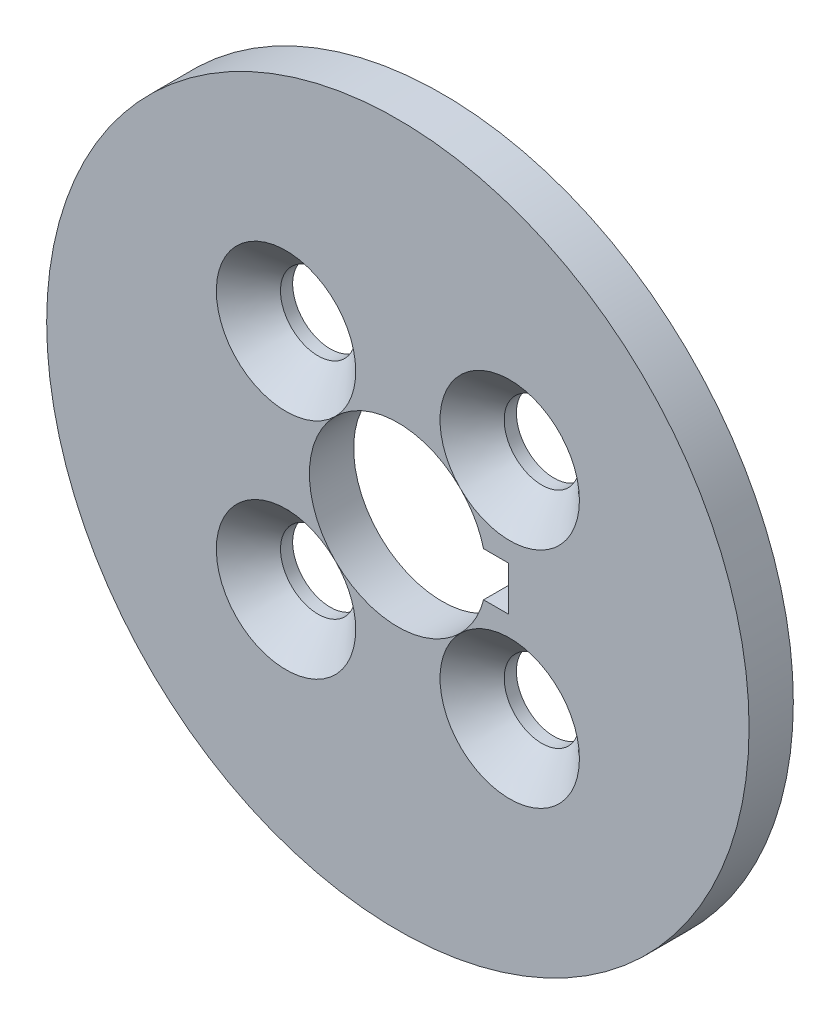
from build123d import *

# Parameters (mm, degrees)
SKETCH2_R                                      = 15.875
SKETCH2_R_2                                    = 1.7
SKETCH2_R_3                                    = 4
BOSS_EXTRUDE1_DEPTH                            = 2
CSK_FOR_M3_FLAT_HEAD_MACHINE_SCREW2_AT_2_COUNT = 2
CSK_FOR_M3_FLAT_HEAD_MACHINE_SCREW2_AT_2_PITCH = 10.111626971
CSK_FOR_M3_FLAT_HEAD_MACHINE_SCREW2_AT_3_COUNT = 2
CSK_FOR_M3_FLAT_HEAD_MACHINE_SCREW2_AT_3_PITCH = 14.3
CSK_FOR_M3_FLAT_HEAD_MACHINE_SCREW2_AT_4_COUNT = 2
CSK_FOR_M3_FLAT_HEAD_MACHINE_SCREW2_AT_4_PITCH = 10.111626971
SKETCH5_W                                      = 1.314472485
SKETCH5_H                                      = 2
CUT_EXTRUDE1_DEPTH                             = 211.522713644


with BuildPart() as part:
    # Sketch2 → Boss-Extrude1 (new body)
    with BuildSketch(Plane.XY):
        with Locations((-160.606756626, 98.885631483)):
            Circle(SKETCH2_R)
        with Locations((-165.662570112, 103.941444968)):
            Circle(SKETCH2_R_2, mode=Mode.SUBTRACT)
        with Locations((-155.550943141, 103.941444968)):
            Circle(SKETCH2_R_2, mode=Mode.SUBTRACT)
        with Locations((-155.550943141, 93.829817997)):
            Circle(SKETCH2_R_2, mode=Mode.SUBTRACT)
        with Locations((-165.662570112, 93.829817997)):
            Circle(SKETCH2_R_2, mode=Mode.SUBTRACT)
        with Locations((-160.606756626, 98.885631483)):
            Circle(SKETCH2_R_3, mode=Mode.SUBTRACT)
    extrude(amount=BOSS_EXTRUDE1_DEPTH)

    # Sketch4 → CSK for M3 Flat Head Machine Screw2 (revolve, cut)
    with BuildSketch(Plane(origin=(-165.662570112, 103.941444968, 2), x_dir=(0, -1, 0), z_dir=(1, 0, 0))):
        Polygon((0, 0), (0, 2), (1.7, 2), (1.7, 1.45), (3.15, 0), align=None)
    csk_for_m3_flat_head_machine_screw2 = revolve(axis=Axis((-165.662570112, 103.941444968, 8.35), (0, 0, -1)), mode=Mode.SUBTRACT)

    # CSK for M3 Flat Head Machine Screw2 at 2: CSK for M3 Flat Head Machine Screw2 ×2
    with Locations(*[(i * CSK_FOR_M3_FLAT_HEAD_MACHINE_SCREW2_AT_2_PITCH, 0, 0) for i in range(1, CSK_FOR_M3_FLAT_HEAD_MACHINE_SCREW2_AT_2_COUNT)]):
        add(csk_for_m3_flat_head_machine_screw2, mode=Mode.SUBTRACT)

    # CSK for M3 Flat Head Machine Screw2 at 3: CSK for M3 Flat Head Machine Screw2 ×2
    with Locations(*[Vector(0.7071067811865639, -0.7071067811865311, 0) * (i * CSK_FOR_M3_FLAT_HEAD_MACHINE_SCREW2_AT_3_PITCH) for i in range(1, CSK_FOR_M3_FLAT_HEAD_MACHINE_SCREW2_AT_3_COUNT)]):
        add(csk_for_m3_flat_head_machine_screw2, mode=Mode.SUBTRACT)

    # CSK for M3 Flat Head Machine Screw2 at 4: CSK for M3 Flat Head Machine Screw2 ×2
    with Locations(*[(0, -i * CSK_FOR_M3_FLAT_HEAD_MACHINE_SCREW2_AT_4_PITCH, 0) for i in range(1, CSK_FOR_M3_FLAT_HEAD_MACHINE_SCREW2_AT_4_COUNT)]):
        add(csk_for_m3_flat_head_machine_screw2, mode=Mode.SUBTRACT)

    # Sketch5 → Cut-Extrude1 (cut, through all)
    with BuildSketch(Plane(origin=(0, 0, 0), x_dir=(-1, 0, 0), z_dir=(0, 0, -1))):
        with Locations((156.263992868, 98.885631483)):
            Rectangle(SKETCH5_W, SKETCH5_H)
    extrude(amount=-CUT_EXTRUDE1_DEPTH, mode=Mode.SUBTRACT)


solid = part.part
